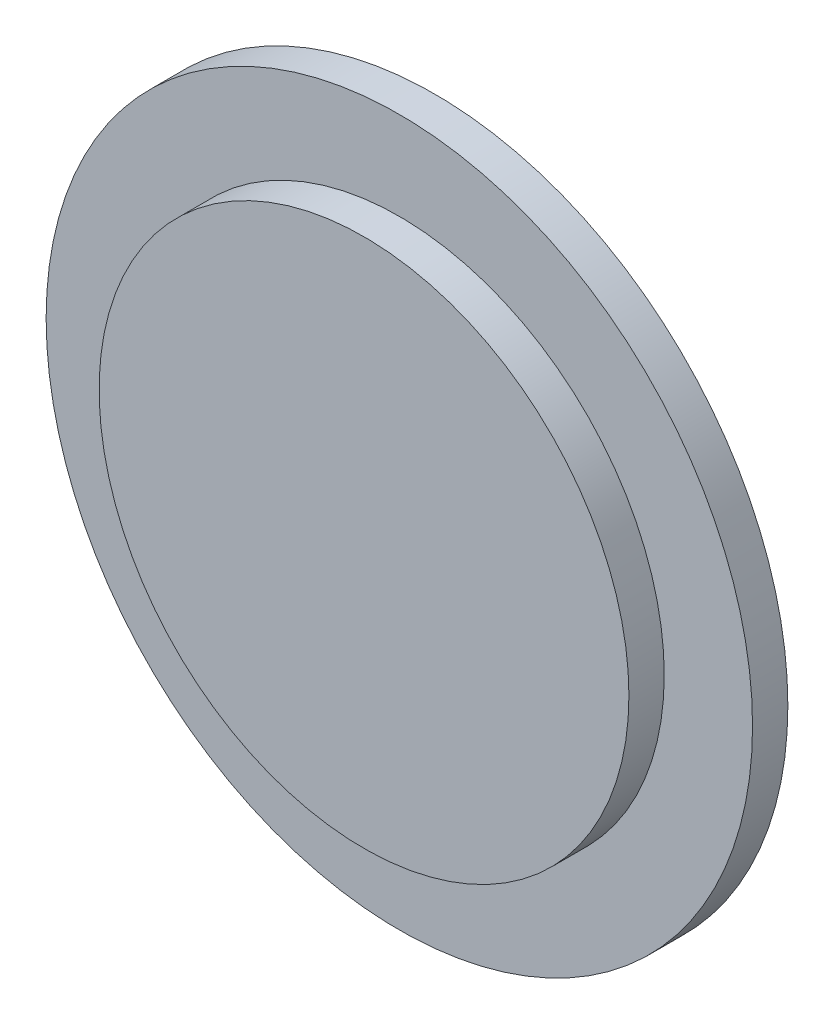
from build123d import *

# Parameters (mm, degrees)
SKETCH1_R           = 7.5
BOSS_EXTRUDE1_DEPTH = 1.5
SKETCH2_R           = 10
BOSS_EXTRUDE2_DEPTH = 0.5


with BuildPart() as part:
    # Sketch1 → Boss-Extrude1 (new, symmetric)
    with BuildSketch(Plane.XY):
        Circle(SKETCH1_R)
    extrude(amount=BOSS_EXTRUDE1_DEPTH, both=True)

    # Sketch2 → Boss-Extrude2 (add, symmetric)
    with BuildSketch(Plane.XY):
        Circle(SKETCH2_R)
    extrude(amount=BOSS_EXTRUDE2_DEPTH, both=True)


solid = part.part
